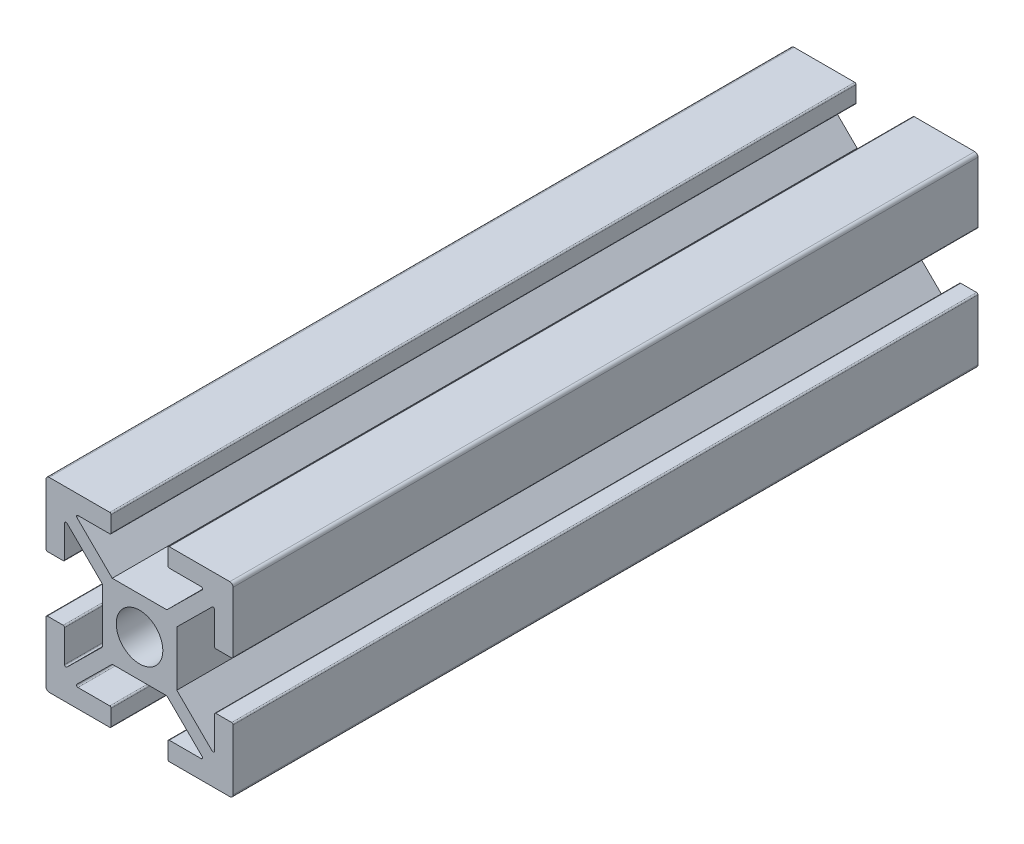
from build123d import *

# Parameters (mm, degrees)
SKETCH1_R           = 2.5
BOSS_EXTRUDE1_DEPTH = 80


with BuildPart() as part:
    # Sketch1 → Boss-Extrude1 (new body)
    with BuildSketch(Plane.XY):
        with BuildLine():
            Line((-31.376404226, -0.06181021), (-29.676404226, -0.06181021))
            ThreePointArc((-29.676404226, -0.06181021), (-29.570338208, -0.017876227), (-29.526404226, 0.08818979))
            Line((-29.526404226, 0.08818979), (-29.526404226, 3.524374304))
            ThreePointArc((-29.526404226, 3.524374304), (-29.43420518, 3.662790523), (-29.27095023, 3.631048831))
            Line((-29.27095023, 3.631048831), (-25.480107929, -0.116419988))
            Line((-25.480107929, -0.116419988), (-25.480107929, -6.007200432))
            Line((-25.480107929, -6.007200432), (-29.27095023, -9.754669251))
            ThreePointArc((-29.27095023, -9.754669251), (-29.43420518, -9.786410942), (-29.526404226, -9.647994723))
            Line((-29.526404226, -9.647994723), (-29.526404226, -6.21181021))
            ThreePointArc((-29.526404226, -6.21181021), (-29.570338208, -6.105744193), (-29.676404226, -6.06181021))
            Line((-29.676404226, -6.06181021), (-31.376404226, -6.06181021))
            ThreePointArc((-31.376404226, -6.06181021), (-31.482470243, -6.105744193), (-31.526404226, -6.21181021))
            Line((-31.526404226, -6.21181021), (-31.526404226, -12.71181021))
            ThreePointArc((-31.526404226, -12.71181021), (-31.423891599, -12.959297583), (-31.176404226, -13.06181021))
            Line((-31.176404226, -13.06181021), (-24.676404226, -13.06181021))
            ThreePointArc((-24.676404226, -13.06181021), (-24.570338208, -13.017876227), (-24.526404226, -12.91181021))
            Line((-24.526404226, -12.91181021), (-24.526404226, -11.21181021))
            ThreePointArc((-24.526404226, -11.21181021), (-24.570338208, -11.105744193), (-24.676404226, -11.06181021))
            Line((-24.676404226, -11.06181021), (-28.094489023, -11.06181021))
            ThreePointArc((-28.094489023, -11.06181021), (-28.233235517, -10.96881381), (-28.199943018, -10.805135682))
            Line((-28.199943018, -10.805135682), (-24.41329202, -7.06181021))
            Line((-24.41329202, -7.06181021), (-18.546923839, -7.06181021))
            Line((-18.546923839, -7.06181021), (-14.760272841, -10.805135682))
            ThreePointArc((-14.760272841, -10.805135682), (-14.726980342, -10.96881381), (-14.865726836, -11.06181021))
            Line((-14.865726836, -11.06181021), (-18.283811633, -11.06181021))
            ThreePointArc((-18.283811633, -11.06181021), (-18.38987765, -11.105744193), (-18.433811633, -11.21181021))
            Line((-18.433811633, -11.21181021), (-18.433811633, -12.91181021))
            ThreePointArc((-18.433811633, -12.91181021), (-18.38987765, -13.017876227), (-18.283811633, -13.06181021))
            Line((-18.283811633, -13.06181021), (-11.783811633, -13.06181021))
            ThreePointArc((-11.783811633, -13.06181021), (-11.53632426, -12.959297583), (-11.433811633, -12.71181021))
            Line((-11.433811633, -12.71181021), (-11.433811633, -6.21181021))
            ThreePointArc((-11.433811633, -6.21181021), (-11.477745616, -6.105744193), (-11.583811633, -6.06181021))
            Line((-11.583811633, -6.06181021), (-13.283811633, -6.06181021))
            ThreePointArc((-13.283811633, -6.06181021), (-13.38987765, -6.105744193), (-13.433811633, -6.21181021))
            Line((-13.433811633, -6.21181021), (-13.433811633, -9.647994723))
            ThreePointArc((-13.433811633, -9.647994723), (-13.526010678, -9.786410942), (-13.689265628, -9.754669251))
            Line((-13.689265628, -9.754669251), (-17.480107929, -6.007200432))
            Line((-17.480107929, -6.007200432), (-17.480107929, -0.116419988))
            Line((-17.480107929, -0.116419988), (-13.689265628, 3.631048831))
            ThreePointArc((-13.689265628, 3.631048831), (-13.526010678, 3.662790523), (-13.433811633, 3.524374304))
            Line((-13.433811633, 3.524374304), (-13.433811633, 0.08818979))
            ThreePointArc((-13.433811633, 0.08818979), (-13.38987765, -0.017876227), (-13.283811633, -0.06181021))
            Line((-13.283811633, -0.06181021), (-11.583811633, -0.06181021))
            ThreePointArc((-11.583811633, -0.06181021), (-11.477745616, -0.017876227), (-11.433811633, 0.08818979))
            Line((-11.433811633, 0.08818979), (-11.433811633, 6.58818979))
            ThreePointArc((-11.433811633, 6.58818979), (-11.53632426, 6.835677164), (-11.783811633, 6.93818979))
            Line((-11.783811633, 6.93818979), (-18.283811633, 6.93818979))
            ThreePointArc((-18.283811633, 6.93818979), (-18.38987765, 6.894255807), (-18.433811633, 6.78818979))
            Line((-18.433811633, 6.78818979), (-18.433811633, 5.08818979))
            ThreePointArc((-18.433811633, 5.08818979), (-18.38987765, 4.982123773), (-18.283811633, 4.93818979))
            Line((-18.283811633, 4.93818979), (-14.865726836, 4.93818979))
            ThreePointArc((-14.865726836, 4.93818979), (-14.726980342, 4.84519339), (-14.760272841, 4.681515262))
            Line((-14.760272841, 4.681515262), (-18.546923839, 0.93818979))
            Line((-18.546923839, 0.93818979), (-24.41329202, 0.93818979))
            Line((-24.41329202, 0.93818979), (-28.199943018, 4.681515262))
            ThreePointArc((-28.199943018, 4.681515262), (-28.233235517, 4.84519339), (-28.094489023, 4.93818979))
            Line((-28.094489023, 4.93818979), (-24.676404226, 4.93818979))
            ThreePointArc((-24.676404226, 4.93818979), (-24.570338208, 4.982123773), (-24.526404226, 5.08818979))
            Line((-24.526404226, 5.08818979), (-24.526404226, 6.78818979))
            ThreePointArc((-24.526404226, 6.78818979), (-24.570338208, 6.894255807), (-24.676404226, 6.93818979))
            Line((-24.676404226, 6.93818979), (-31.176404226, 6.93818979))
            ThreePointArc((-31.176404226, 6.93818979), (-31.423891599, 6.835677164), (-31.526404226, 6.58818979))
            Line((-31.526404226, 6.58818979), (-31.526404226, 0.08818979))
            ThreePointArc((-31.526404226, 0.08818979), (-31.482470243, -0.017876227), (-31.376404226, -0.06181021))
        make_face()
        with Locations((-21.480107929, -3.06181021)):
            Circle(SKETCH1_R, mode=Mode.SUBTRACT)
    extrude(amount=BOSS_EXTRUDE1_DEPTH)


solid = part.part
